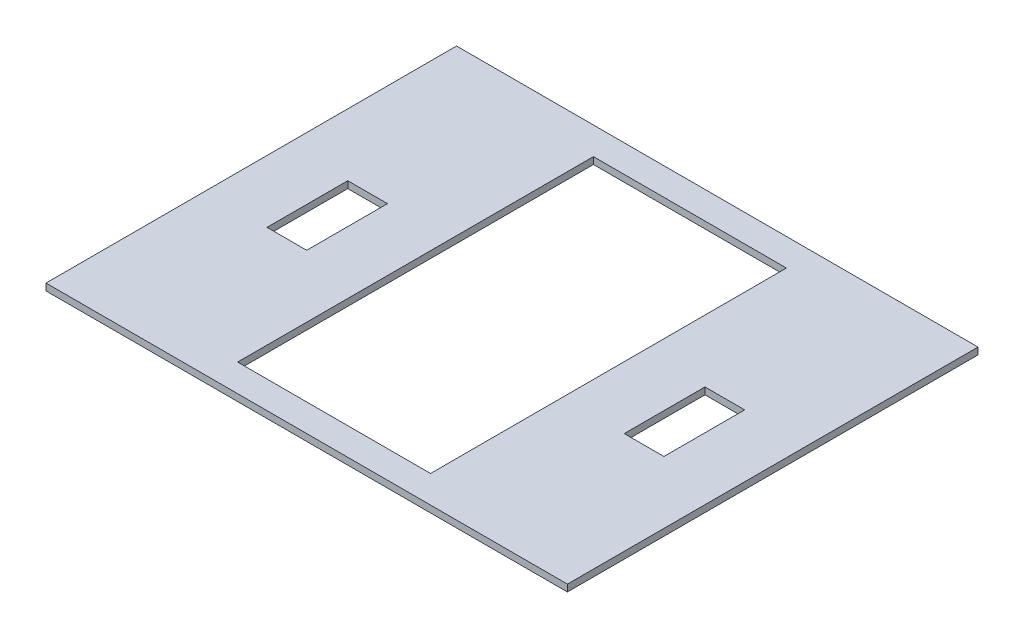
from build123d import *

# Parameters (mm, degrees)
SKETCH1_W           = 381
SKETCH1_H           = 300
BOSS_EXTRUDE2_DEPTH = 5
SKETCH3_W           = 29
SKETCH3_H           = 59
SKETCH3_W_2         = 141
SKETCH3_H_2         = 260
CUT_EXTRUDE2_DEPTH  = 5


with BuildPart() as part:
    # Sketch1 → Boss-Extrude2 (new body)
    with BuildSketch(Plane(origin=(0, 0, 0), x_dir=(1, 0, 0), z_dir=(0, 1, 0))):
        with Locations((190.5, 150)):
            Rectangle(SKETCH1_W, SKETCH1_H)
    extrude(amount=BOSS_EXTRUDE2_DEPTH)

    # Sketch3 → Cut-Extrude2 (cut)
    with BuildSketch(Plane(origin=(0, 5, 0), x_dir=(1, 0, 0), z_dir=(0, 1, 0))):
        with Locations((60, 145.5)):
            Rectangle(SKETCH3_W, SKETCH3_H)
        with Locations((321, 145.5)):
            Rectangle(SKETCH3_W, SKETCH3_H)
        with Locations((190.5, 150)):
            Rectangle(SKETCH3_W_2, SKETCH3_H_2)
    extrude(amount=-CUT_EXTRUDE2_DEPTH, mode=Mode.SUBTRACT)


solid = part.part
